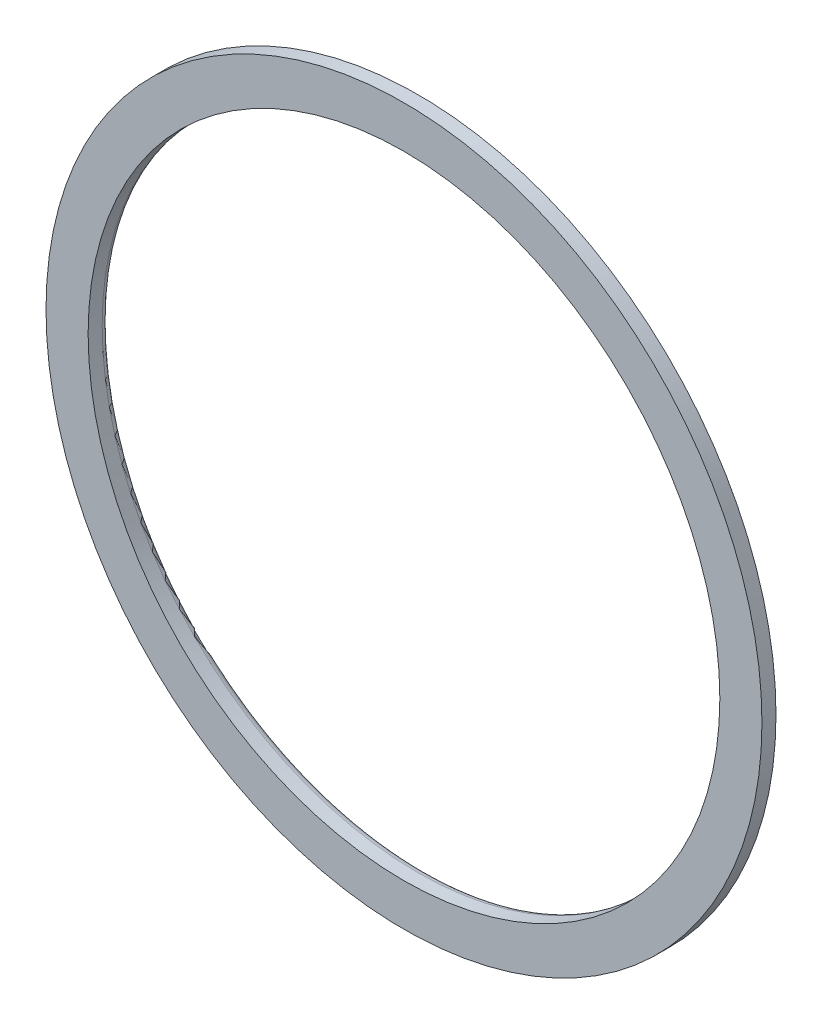
from build123d import *


with BuildPart() as part:
    # 草图2 → 旋转1 (revolve)
    with BuildSketch(Plane(origin=(0, 0, 0), x_dir=(1, 0, 0), z_dir=(0, 1, 0))):
        with BuildLine():
            Line((47, 2), (51, 2))
            Line((51, 2), (51, 0))
            Line((51, 0), (45, 0))
            Line((45, 0), (45, 2))
            ThreePointArc((45, 2), (46, 3), (47, 2))
        make_face()
    revolve(axis=Axis((0, 0, 0), (0, 0, -1)))


solid = part.part
